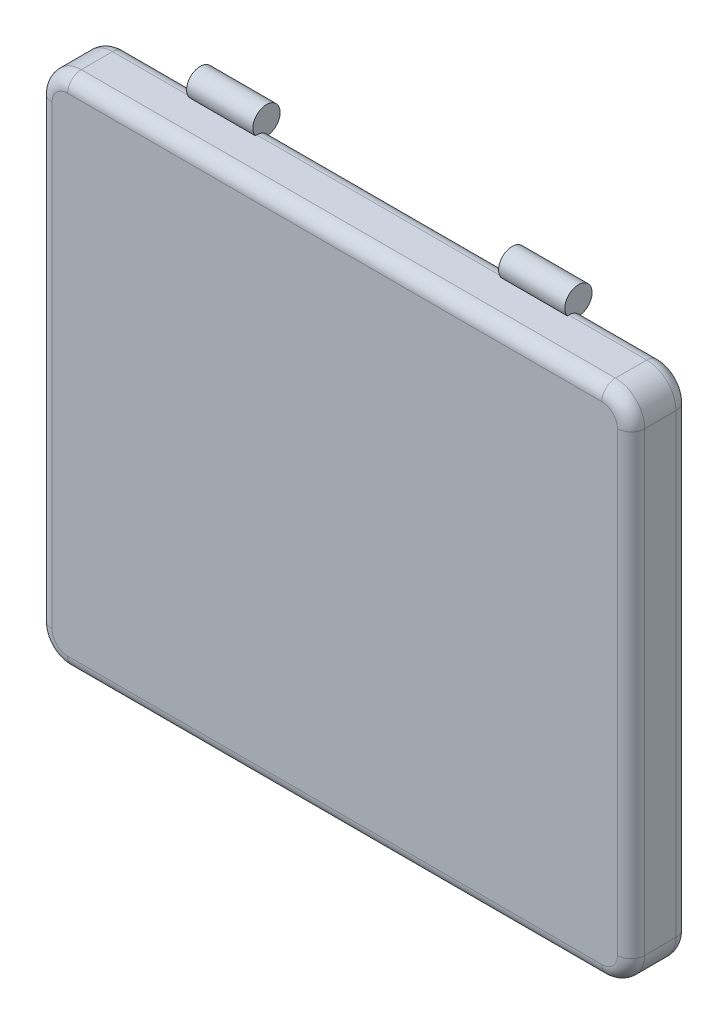
from build123d import *

# Parameters (mm, degrees)
BLOCK_START            = 465
BLOCK_1_DEPTH          = 30
BLOCK_EDGE_FILLET_1_R  = 7
EXTRUDE_START          = -17
EXTRUDE_SKETCH_1_R     = 7
EXTRUDE_1_DEPTH        = 34
EXTRUDE_ROTATE_1_ANGLE = 90
EXTRUDE_SKETCH_2_R     = 7
EXTRUDE_2_DEPTH        = 34
EXTRUDE_ROTATE_2_ANGLE = 90


with BuildPart() as part:
    # Block sketch 1 → Block 1 (new body)
    with BuildSketch(Plane.XY.offset(BLOCK_START)):
        with BuildLine():
            Line((358, -132), (632, -132))
            ThreePointArc((632, -132), (642.606601718, -127.606601718), (647, -117))
            Line((647, -117), (647, 117))
            ThreePointArc((647, 117), (642.606601718, 127.606601718), (632, 132))
            Line((632, 132), (358, 132))
            ThreePointArc((358, 132), (347.393398282, 127.606601718), (343, 117))
            Line((343, 117), (343, -117))
            ThreePointArc((343, -117), (347.393398282, -127.606601718), (358, -132))
        make_face()
    extrude(amount=BLOCK_1_DEPTH)

    # Block edge fillet 1
    block_edge_fillet_1_edges = [part.edges().sort_by_distance(p)[0] for p in [
        (347.393398282, -127.606601718, 495),
        (347.393398282, 127.606601718, 495),
        (642.606601718, 127.606601718, 495),
        (642.606601718, -127.606601718, 495),
        (642.606601718, 127.606601718, 465),
        (642.606601718, -127.606601718, 465),
        (495, -132, 465),
        (347.393398282, -127.606601718, 465),
        (343, 0, 465),
        (347.393398282, 127.606601718, 465),
        (647, 0, 495),
        (343, 0, 495),
        (495, 132, 495),
        (495, -132, 495),
        (647, 0, 465),
        (495, 132, 465),
    ]]
    fillet(block_edge_fillet_1_edges, radius=BLOCK_EDGE_FILLET_1_R)


with BuildPart() as body_2:
    # Extrude sketch 1 → Extrude 1 (new body)
    with BuildSketch(Plane.XY.offset(EXTRUDE_START)):
        Circle(EXTRUDE_SKETCH_1_R)
    extrude(amount=EXTRUDE_1_DEPTH)


with BuildPart() as body_2_1:
    # Extrude rotate 1: moved
    add(body_2.part.rotate(Axis((0, 0, 0), (0, 1, 0)), EXTRUDE_ROTATE_1_ANGLE))


with BuildPart() as body_2_2:
    # Extrude place 1: moved
    add(body_2_1.part.moved(Location((415, 136, 467))))


with BuildPart() as body_3:
    # Extrude sketch 2 → Extrude 2 (new body)
    with BuildSketch(Plane.XY.offset(EXTRUDE_START)):
        Circle(EXTRUDE_SKETCH_2_R)
    extrude(amount=EXTRUDE_2_DEPTH)


with BuildPart() as body_3_1:
    # Extrude rotate 2: moved
    add(body_3.part.rotate(Axis((0, 0, 0), (0, 1, 0)), EXTRUDE_ROTATE_2_ANGLE))


with BuildPart() as body_3_2:
    # Extrude place 2: moved
    add(body_3_1.part.moved(Location((575, 136, 467))))


with BuildPart() as part_1:
    add(part.part)

    # Combine (weld / assembly of features): union body 3, body 2
    add(body_3_2.part)
    add(body_2_2.part)


solid = part_1.part
